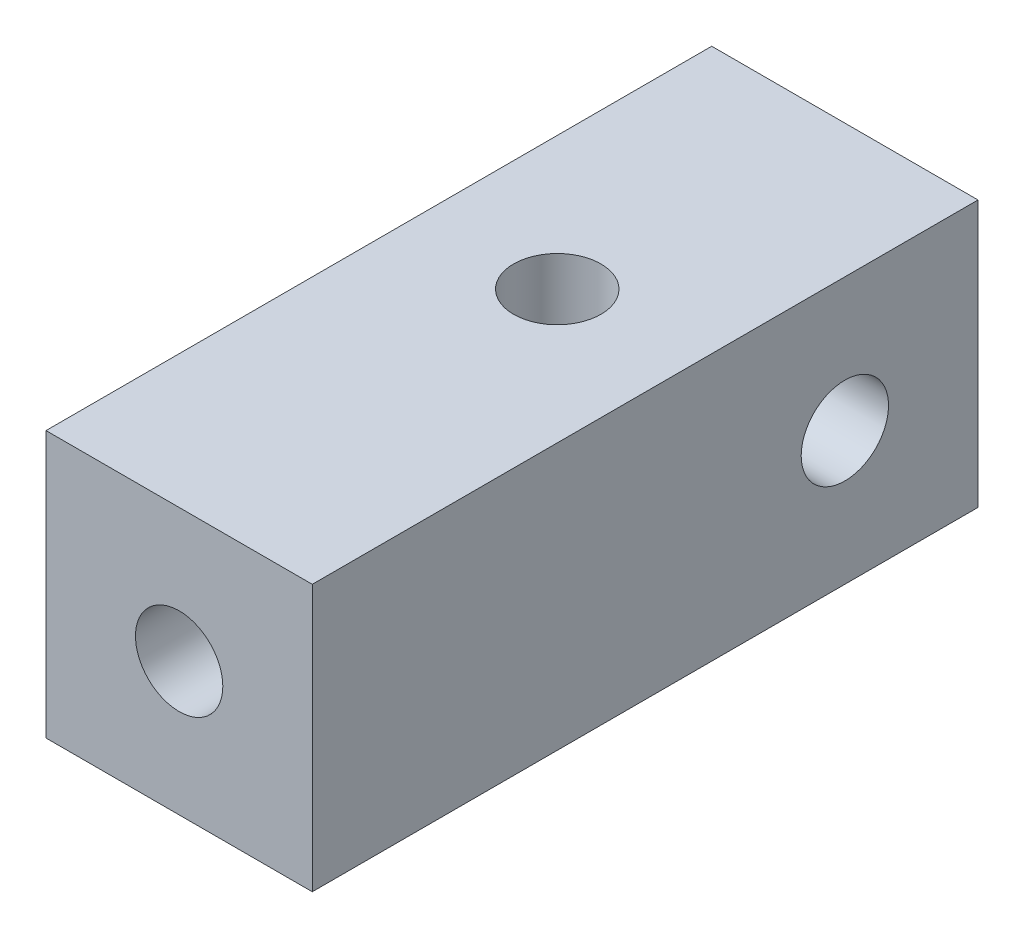
from build123d import *

# Parameters (mm, degrees)
SKETCH1_W           = 12.7
SKETCH1_H           = 31.75
SKETCH1_R           = 2.0828
BOSS_EXTRUDE1_DEPTH = 12.7
SKETCH2_R           = 2.0828
CUT_EXTRUDE1_DEPTH  = 12.7
SKETCH3_R           = 2.0828
CUT_EXTRUDE2_DEPTH  = 12.7


with BuildPart() as part:
    # Sketch1 → Boss-Extrude1 (new body)
    with BuildSketch(Plane(origin=(0, 0, 0), x_dir=(1, 0, 0), z_dir=(0, 1, 0))):
        with Locations((6.35, 15.875)):
            Rectangle(SKETCH1_W, SKETCH1_H)
        with Locations(Location((6.35, 18.034, 0), (0, 0, 270))):
            Circle(SKETCH1_R, mode=Mode.SUBTRACT)
    extrude(amount=BOSS_EXTRUDE1_DEPTH)

    # Sketch2 → Cut-Extrude1 (cut)
    with BuildSketch(Plane.XY):
        with Locations((6.35, 6.35)):
            Circle(SKETCH2_R)
    extrude(amount=-CUT_EXTRUDE1_DEPTH, mode=Mode.SUBTRACT)

    # Sketch3 → Cut-Extrude2 (cut)
    with BuildSketch(Plane.ZY):
        with Locations((-25.4, 6.35)):
            Circle(SKETCH3_R)
    extrude(amount=-CUT_EXTRUDE2_DEPTH, mode=Mode.SUBTRACT)


solid = part.part
